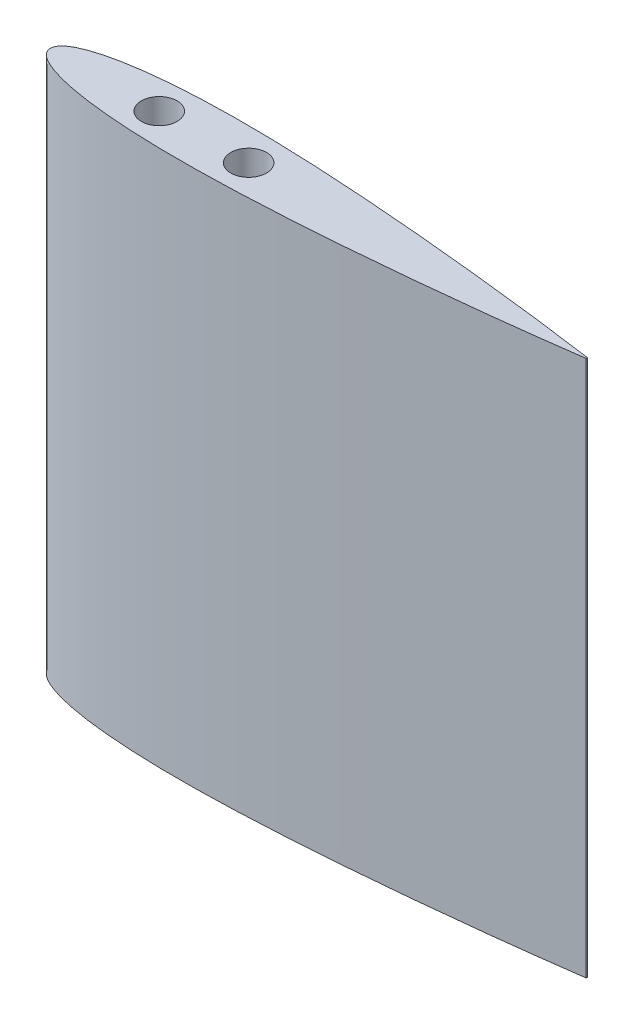
from build123d import *

# Parameters (mm, degrees)
BOSS_EXTRUDE1_DEPTH = 38.1
SKETCH6_R           = 1.27
CUT_EXTRUDE1_DEPTH  = 12.7


with BuildPart() as part:
    # Sketch3 → Boss-Extrude1 (new body)
    with BuildSketch(Plane(origin=(0, 0, 0), x_dir=(1, 0, 0), z_dir=(0, 1, 0))):
        with BuildLine():
            Line((76.19895665, 0.048006), (76.19895665, -0.048006))
            add(Edge.make_bspline(
                [(76.19895665, -0.048006), (76.191539901, -0.049047765), (76.161899562, -0.053211081), (76.043603904, -0.069755857), (75.866518775, -0.094486743), (75.631009171, -0.126965392), (75.389353208, -0.160190201), (75.105083766, -0.198904989), (74.778874587, -0.242859006), (74.411498195, -0.291864294), (74.003808466, -0.345569023), (73.55675533, -0.403720926), (73.071373634, -0.465853222), (72.351016752, -0.55677244), (71.583498246, -0.651127112), (70.770593968, -0.748448048), (70.112310422, -0.825737809), (69.423727944, -0.904853153), (68.706493932, -0.985592031), (67.962261003, -1.067375261), (67.192790939, -1.14998319), (66.39985073, -1.232825488), (65.585309497, -1.315748636), (64.751059625, -1.398113207), (63.89906267, -1.479660513), (63.031297123, -1.559824173), (62.149787269, -1.638342101), (61.256597307, -1.714565201), (60.353808722, -1.788152536), (59.443541436, -1.858634165), (58.527909801, -1.925444296), (57.609065592, -1.988163902), (56.689153719, -2.046291991), (55.466837451, -2.116763144), (54.250026084, -2.176215597), (52.747668806, -2.234066929), (51.564928198, -2.266645454), (50.399047782, -2.283584551), (49.546991679, -2.288048273), (48.712683305, -2.284102235), (47.898075257, -2.271569022), (47.10507642, -2.250069868), (46.335521203, -2.21969991), (45.59120526, -2.180240934), (44.873861455, -2.131803537), (44.185178969, -2.074397819), (43.526758948, -2.008128116), (42.900131253, -1.933245819), (42.306740505, -1.850055304), (41.747984592, -1.758711647), (41.225144077, -1.659671366), (40.739422269, -1.55330687), (40.291954338, -1.439978722), (39.883729051, -1.320194614), (39.515646542, -1.194352348), (39.188491768, -1.062886557), (38.902912347, -0.926176493), (38.659452345, -0.784506781), (38.45839526, -0.638117579), (38.30012959, -0.486768084), (38.185036997, -0.330029549), (38.114669204, -0.167135854), (38.091297694, 0), (38.114669204, 0.167135854), (38.185036997, 0.330029549), (38.30012959, 0.486768084), (38.45839526, 0.638117579), (38.659452345, 0.784506781), (38.902912347, 0.926176493), (39.188491768, 1.062886557), (39.515646542, 1.194352348), (39.883729051, 1.320194614), (40.291954338, 1.439978722), (40.739422269, 1.55330687), (41.225144077, 1.659671366), (41.747984592, 1.758711647), (42.306740505, 1.850055304), (42.900131253, 1.933245819), (43.526758948, 2.008128116), (44.185178969, 2.074397819), (44.873861455, 2.131803537), (45.59120526, 2.180240934), (46.335521203, 2.21969991), (47.10507642, 2.250069868), (47.898075257, 2.271569022), (48.712683305, 2.284102235), (49.546991679, 2.288048273), (50.399047782, 2.283584551), (51.564928198, 2.266645454), (53.051532419, 2.225697023), (54.553689234, 2.162253193), (55.770303488, 2.09926718), (56.689153719, 2.046291991), (57.609065592, 1.988163902), (58.527909801, 1.925444296), (59.443541436, 1.858634165), (60.353808722, 1.788152536), (61.256597307, 1.714565201), (62.149787269, 1.638342101), (63.031297123, 1.559824173), (63.89906267, 1.479660513), (64.751059625, 1.398113207), (65.585309497, 1.315748636), (66.39985073, 1.232825488), (67.192790939, 1.14998319), (67.962261003, 1.067375261), (68.706493932, 0.985592031), (69.423727944, 0.904853153), (70.112310422, 0.825737809), (70.770593968, 0.748448048), (71.583498246, 0.651127112), (72.351016752, 0.55677244), (73.071373634, 0.465853222), (73.55675533, 0.403720926), (74.003808466, 0.345569023), (74.411498195, 0.291864294), (74.778874587, 0.242859006), (75.105083766, 0.198904989), (75.389353208, 0.160190201), (75.631009171, 0.126965392), (75.866518775, 0.094486743), (76.043603904, 0.069755857), (76.161899562, 0.053211081), (76.191539901, 0.049047765), (76.19895665, 0.048006)],
                knots=[0, 0, 0, 0, 0.000289201, 0.001155766, 0.004612322, 0.007193518, 0.010335793, 0.014031397, 0.018271612, 0.023045847, 0.028342901, 0.03415012, 0.04045376, 0.04723833, 0.062186613, 0.070313724, 0.078851908, 0.087780126, 0.097077521, 0.106722049, 0.116690868, 0.126960505, 0.137507218, 0.148306055, 0.159330765, 0.17055649, 0.181956531, 0.193504043, 0.205171367, 0.2169323, 0.228758169, 0.2406214, 0.252494936, 0.264350287, 0.287897994, 0.299535854, 0.322404759, 0.333584032, 0.344559266, 0.35530596, 0.365799778, 0.37601757, 0.3859373, 0.395537659, 0.404797976, 0.413698812, 0.422221441, 0.430349273, 0.438066019, 0.445356904, 0.452209372, 0.458611567, 0.464554044, 0.47002985, 0.475034902, 0.479569141, 0.483636857, 0.487250263, 0.490431338, 0.493218828, 0.495674086, 0.497891368, 0.5, 0.502108632, 0.504325914, 0.506781172, 0.509568662, 0.512749737, 0.516363143, 0.520430859, 0.524965098, 0.52997015, 0.535445956, 0.541388433, 0.547790628, 0.554643096, 0.561933981, 0.569650727, 0.577778559, 0.586301188, 0.595202024, 0.604462341, 0.6140627, 0.62398243, 0.634200222, 0.64469404, 0.655440734, 0.666415968, 0.677595241, 0.700464146, 0.723839427, 0.735649713, 0.747505064, 0.7593786, 0.771241831, 0.7830677, 0.794828633, 0.806495957, 0.818043469, 0.82944351, 0.840669235, 0.851693945, 0.862492782, 0.873039495, 0.883309132, 0.893277951, 0.902922479, 0.912219874, 0.921148092, 0.929686276, 0.937813387, 0.95276167, 0.95954624, 0.96584988, 0.971657099, 0.976954153, 0.981728388, 0.985968603, 0.989664207, 0.992806482, 0.995387678, 0.998844234, 0.999710799, 1, 1, 1, 1], degree=3))
        make_face()
    extrude(amount=BOSS_EXTRUDE1_DEPTH)

    # Sketch6 → Cut-Extrude1 (cut)
    with BuildSketch(Plane(origin=(0, 38.1, 0), x_dir=(1, 0, 0), z_dir=(0, 1, 0))):
        with Locations(Location((45.830507372, 0, 0), (0, 0, 270))):
            Circle(SKETCH6_R)
        with Locations(Location((52.180507372, 0, 0), (0, 0, 270))):
            Circle(SKETCH6_R)
    extrude(amount=-CUT_EXTRUDE1_DEPTH, mode=Mode.SUBTRACT)


solid = part.part
